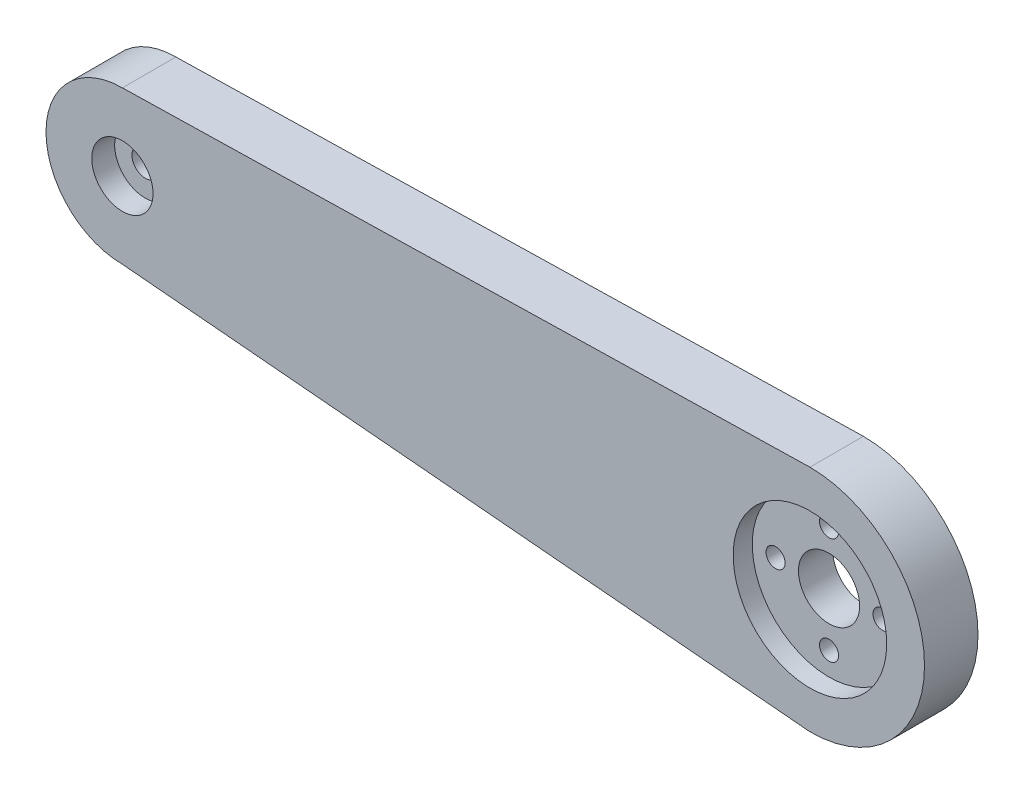
from build123d import *

# Parameters (mm, degrees)
EXTRUDE_1_DEPTH     = 7
SKETCH_2_R          = 4.1
SKETCH_2_R_2        = 1.25
SKETCH_2_R_3        = 4
CUT_EXTRUDE_1_DEPTH = 10
SKETCH_3_R          = 10.05
CUT_EXTRUDE_2_DEPTH = 2.5
EXTRUDE_START       = -7
SKETCH_4_R          = 4.1
EXTRUDE_5_DEPTH     = 7
SKETCH_6_R          = 4.01
CUT_EXTRUDE_6_DEPTH = 3
SKETCH_8_R          = 1.75
CUT_EXTRUDE_7_DEPTH = 10


with BuildPart() as part:
    # 草图1 → 凸台-拉伸1 (new body)
    with BuildSketch(Plane.XY):
        with BuildLine():
            Line((0, -10), (90, -18))
            ThreePointArc((90, -18), (105, -3), (90, 12))
            Line((90, 12), (0, 10))
            ThreePointArc((0, 10), (-10, 0), (0, -10))
        make_face()
    extrude(amount=EXTRUDE_1_DEPTH)

    # 草图2 → 切除-拉伸1 (cut)
    with BuildSketch(Plane(origin=(0, 0, 0), x_dir=(-1, 0, 0), z_dir=(0, 0, -1))):
        Circle(SKETCH_2_R)
        with Locations((-90, -10)):
            Circle(SKETCH_2_R_2)
        with Locations((-83, -3)):
            Circle(SKETCH_2_R_2)
        with Locations((-90, 4)):
            Circle(SKETCH_2_R_2)
        with Locations((-97, -3)):
            Circle(SKETCH_2_R_2)
        with Locations((-90, -3)):
            Circle(SKETCH_2_R_3)
    extrude(amount=-CUT_EXTRUDE_1_DEPTH, mode=Mode.SUBTRACT)

    # 草图3 → 切除-拉伸2 (cut)
    with BuildSketch(Plane.XY.offset(7)):
        with Locations((90, -3)):
            Circle(SKETCH_3_R)
    extrude(amount=-CUT_EXTRUDE_2_DEPTH, mode=Mode.SUBTRACT)

    # 草图4 → 凸台-拉伸5 (add)
    with BuildSketch(Plane.XY.offset(7).offset(EXTRUDE_START)):
        Circle(SKETCH_4_R)
    extrude(amount=EXTRUDE_5_DEPTH)

    # 草图6 → 切除-拉伸6 (cut)
    with BuildSketch(Plane.XY.offset(7)):
        Circle(SKETCH_6_R)
    extrude(amount=-CUT_EXTRUDE_6_DEPTH, mode=Mode.SUBTRACT)

    # 草图8 → 切除-拉伸7 (cut)
    with BuildSketch(Plane(origin=(0, 0, 0), x_dir=(-1, 0, 0), z_dir=(0, 0, -1))):
        Circle(SKETCH_8_R)
    extrude(amount=-CUT_EXTRUDE_7_DEPTH, mode=Mode.SUBTRACT)


solid = part.part
